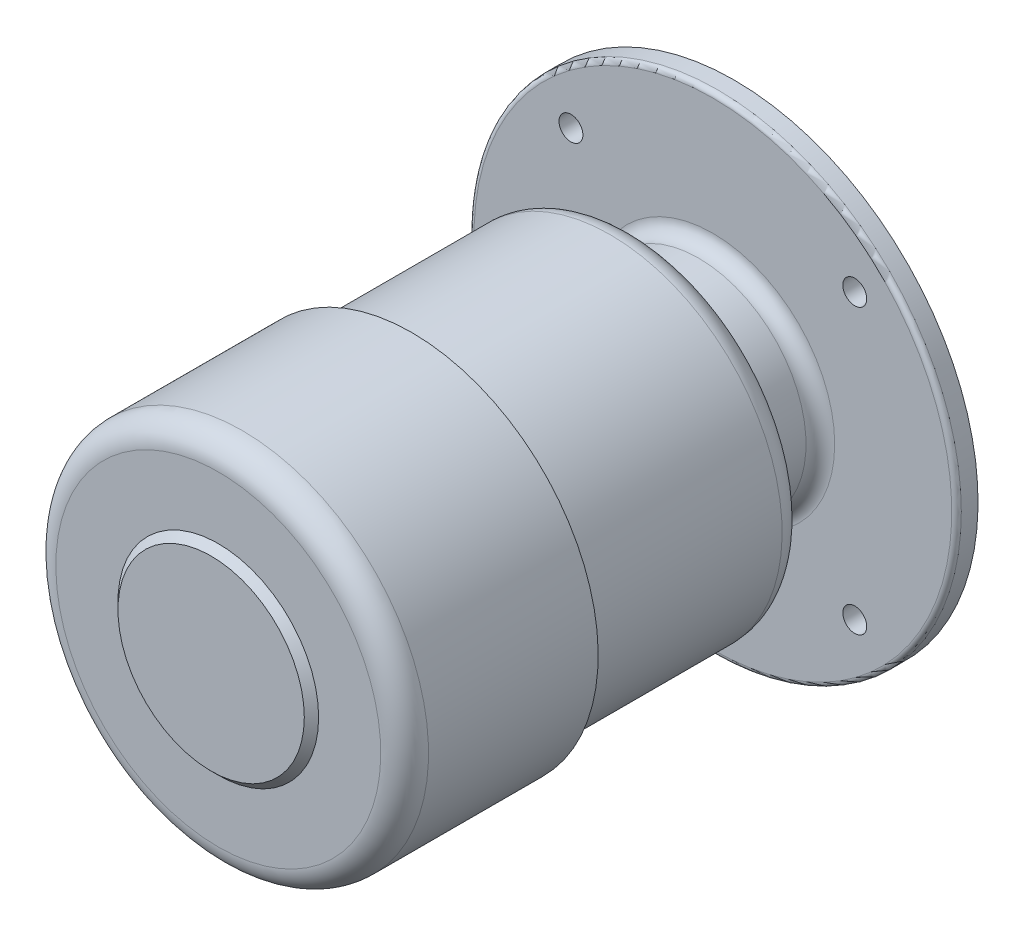
from build123d import *

# Parameters (mm, degrees)
ESQUISSE2_R                      = 66
EXTRUSION1_DEPTH                 = 6
EXTRUSION2_DEPTH                 = 36
ESQUISSE4_R                      = 42
EXTRUSION3_DEPTH                 = 3
EXTRUSION3_TAPER                 = 45
DIAM_TRE_DU_PER_AGE_M10_0_10_1_D = 10
DIAM_TRE_DU_PER_AGE_M10_0_10_2_D = 10
DIAM_TRE_DU_PER_AGE_M10_0_10_3_D = 10
DIAM_TRE_DU_PER_AGE_M10_0_10_4_D = 10
CHANFREIN1_SIZE                  = 2
CONG_1_R                         = 2
CONG_2_R                         = 6
CONG_3_R                         = 6
CONG_4_R                         = 10
CONG_5_R                         = 10


with BuildPart() as part:
    # Esquisse1 → Révolution1 (revolve)
    with BuildSketch(Plane.XZ, mode=Mode.PRIVATE) as r_volution1_sk:
        Polygon((78, 226), (0, 226), (0, 10), (102, 10), (102, 19), (45, 19), (45, 52), (72, 52), (72, 145), (78, 145), align=None)
    revolve(r_volution1_sk.sketch.rotate(Axis((0, 0, 226), (0, 0, -1)), 270), axis=Axis((0, 0, 226), (0, 0, -1)))

    # Esquisse2 → Extrusion1 (add)
    with BuildSketch(Plane(origin=(0, 0, 10), x_dir=(-1, 0, 0), z_dir=(0, 0, -1))):
        with Locations(Location((0, 0, 0), (0, 0, 90))):
            Circle(ESQUISSE2_R)
    extrude(amount=EXTRUSION1_DEPTH)

    # Esquisse3 → Extrusion2 (add)
    with BuildSketch(Plane(origin=(0, 0, 4), x_dir=(-1, 0, 0), z_dir=(0, 0, -1))):
        with BuildLine():
            Line((6.363961031, 2.121320344), (10.337158706, 6.094518019))
            ThreePointArc((10.337158706, 6.094518019), (-8.485281374, -8.485281374), (6.094518019, 10.337158706))
            Line((6.094518019, 10.337158706), (2.121320344, 6.363961031))
            Line((2.121320344, 6.363961031), (6.363961031, 2.121320344))
        make_face()
    extrude(amount=EXTRUSION2_DEPTH)

    # Esquisse4 → Extrusion3 (add)
    with BuildSketch(Plane.XY.offset(226)):
        Circle(ESQUISSE4_R)
    extrude(amount=EXTRUSION3_DEPTH, taper=EXTRUSION3_TAPER)

    # Diamètre du perçage M10.0 (10)1 (through all)
    with Locations(Plane.XY.offset(19)):
        with Locations((59.39696962, -59.39696962)):
            Hole(DIAM_TRE_DU_PER_AGE_M10_0_10_1_D / 2)

    # Diamètre du perçage M10.0 (10)2 (through all)
    with Locations(Plane.XY.offset(19)):
        with Locations((59.39696962, 59.39696962)):
            Hole(DIAM_TRE_DU_PER_AGE_M10_0_10_2_D / 2)

    # Diamètre du perçage M10.0 (10)3 (through all)
    with Locations(Plane.XY.offset(19)):
        with Locations((-59.39696962, -59.39696962)):
            Hole(DIAM_TRE_DU_PER_AGE_M10_0_10_3_D / 2)

    # Diamètre du perçage M10.0 (10)4 (through all)
    with Locations(Plane.XY.offset(19)):
        with Locations((-59.39696962, 59.39696962)):
            Hole(DIAM_TRE_DU_PER_AGE_M10_0_10_4_D / 2)

    # Chanfrein1
    chanfrein1_edges = [part.edges().sort_by_distance(p)[0] for p in [
        (8.485281374, -8.485281374, -32),
    ]]
    chamfer(chanfrein1_edges, length=CHANFREIN1_SIZE)

    # Congé1
    cong_1_edges = [part.edges().sort_by_distance(p)[0] for p in [
        (0, -102, 19),
    ]]
    fillet(cong_1_edges, radius=CONG_1_R)

    # Congé2
    cong_2_edges = [part.edges().sort_by_distance(p)[0] for p in [
        (0, -45, 52),
    ]]
    fillet(cong_2_edges, radius=CONG_2_R)

    # Congé3
    cong_3_edges = [part.edges().sort_by_distance(p)[0] for p in [
        (0, -45, 19),
    ]]
    fillet(cong_3_edges, radius=CONG_3_R)

    # Congé4
    cong_4_edges = [part.edges().sort_by_distance(p)[0] for p in [
        (0, -72, 52),
    ]]
    fillet(cong_4_edges, radius=CONG_4_R)

    # Congé5
    cong_5_edges = [part.edges().sort_by_distance(p)[0] for p in [
        (0, -78, 226),
    ]]
    fillet(cong_5_edges, radius=CONG_5_R)


solid = part.part
